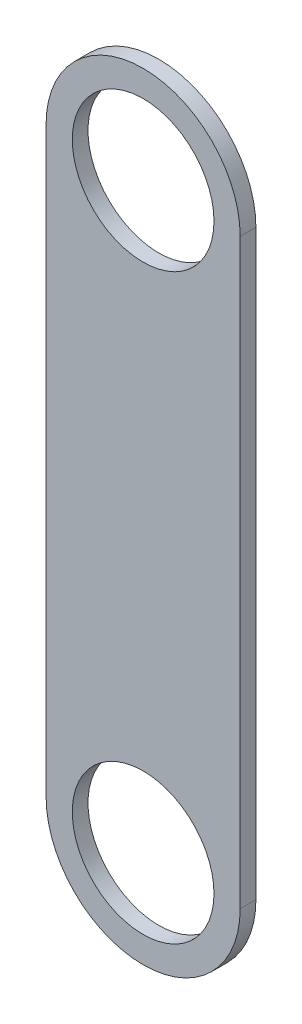
from build123d import *

# Parameters (mm, degrees)
SKETCH1_R           = 9.271
BOSS_EXTRUDE1_DEPTH = 2.0574


with BuildPart() as part:
    # Sketch1 → Boss-Extrude1 (new body)
    with BuildSketch(Plane.XY):
        with BuildLine():
            Line((0, 0), (0, 76.2))
            ThreePointArc((0, 76.2), (12.7, 88.9), (25.4, 76.2))
            Line((25.4, 76.2), (25.4, 0))
            ThreePointArc((25.4, 0), (12.7, -12.7), (0, 0))
        make_face()
        with Locations((12.7, 76.2)):
            Circle(SKETCH1_R, mode=Mode.SUBTRACT)
        with Locations((12.7, 0)):
            Circle(SKETCH1_R, mode=Mode.SUBTRACT)
    extrude(amount=BOSS_EXTRUDE1_DEPTH)


solid = part.part
